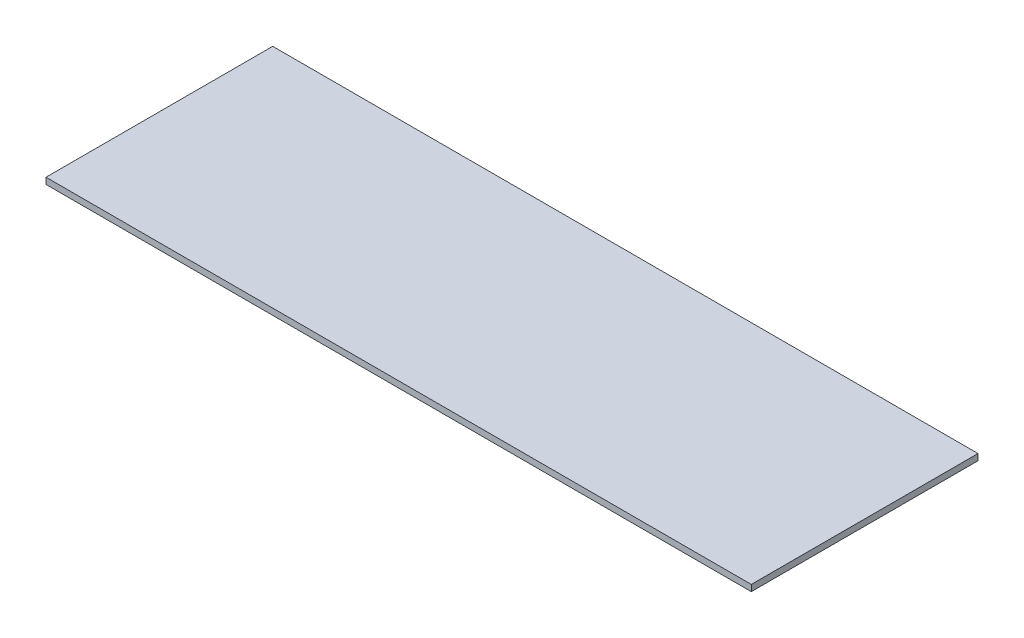
from build123d import *

# Parameters (mm, degrees)
SKETCH1_W           = 711.2
SKETCH1_H           = 228.6
BOSS_EXTRUDE1_DEPTH = 6.35


with BuildPart() as part:
    # Sketch1 → Boss-Extrude1 (new body)
    with BuildSketch(Plane(origin=(0, 0, 0), x_dir=(1, 0, 0), z_dir=(0, 1, 0))):
        Rectangle(SKETCH1_W, SKETCH1_H)
    extrude(amount=BOSS_EXTRUDE1_DEPTH)


solid = part.part
